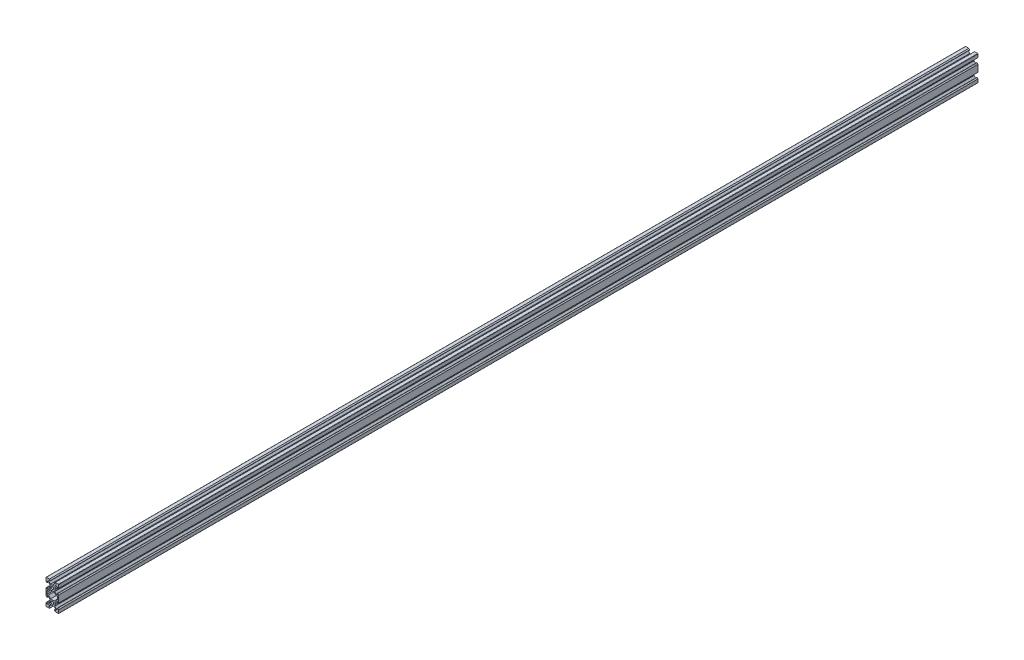
from build123d import *

# Parameters (mm, degrees)
SKETCH1_R           = 2.1
BOSS_EXTRUDE1_DEPTH = 1447.8


with BuildPart() as part:
    # Sketch1 → Boss-Extrude1 (new body)
    with BuildSketch(Plane.XY):
        with BuildLine():
            Line((4.58, -20), (9.5, -20))
            ThreePointArc((9.5, -20), (9.853553391, -19.853553391), (10, -19.5))
            Line((10, -19.5), (10, -14.58))
            Line((10, -14.58), (8.545, -13.125))
            Line((8.545, -13.125), (8.2, -13.125))
            Line((8.2, -13.125), (8.2, -15.5))
            Line((8.2, -15.5), (6.560660172, -15.5))
            Line((6.560660172, -15.5), (3.9, -12.839339828))
            Line((3.9, -12.839339828), (3.9, -10.21))
            Line((3.9, -10.21), (3.69, -10))
            Line((3.69, -10), (3.9, -9.79))
            Line((3.9, -9.79), (3.9, -7.160660172))
            Line((3.9, -7.160660172), (6.560660172, -4.5))
            Line((6.560660172, -4.5), (8.2, -4.5))
            Line((8.2, -4.5), (8.2, -6.875))
            Line((8.2, -6.875), (8.545, -6.875))
            Line((8.545, -6.875), (10, -5.42))
            Line((10, -5.42), (10, 5.42))
            Line((10, 5.42), (8.545, 6.875))
            Line((8.545, 6.875), (8.2, 6.875))
            Line((8.2, 6.875), (8.2, 4.5))
            Line((8.2, 4.5), (6.560660172, 4.5))
            Line((6.560660172, 4.5), (3.9, 7.160660172))
            Line((3.9, 7.160660172), (3.9, 9.79))
            Line((3.9, 9.79), (3.69, 10))
            Line((3.69, 10), (3.9, 10.21))
            Line((3.9, 10.21), (3.9, 12.839339828))
            Line((3.9, 12.839339828), (6.560660172, 15.5))
            Line((6.560660172, 15.5), (8.2, 15.5))
            Line((8.2, 15.5), (8.2, 13.125))
            Line((8.2, 13.125), (8.545, 13.125))
            Line((8.545, 13.125), (10, 14.58))
            Line((10, 14.58), (10, 19.5))
            ThreePointArc((10, 19.5), (9.853553391, 19.853553391), (9.5, 20))
            Line((9.5, 20), (4.58, 20))
            Line((4.58, 20), (3.125, 18.545))
            Line((3.125, 18.545), (3.125, 18.2))
            Line((3.125, 18.2), (5.5, 18.2))
            Line((5.5, 18.2), (5.5, 16.560660172))
            Line((5.5, 16.560660172), (2.839339828, 13.9))
            Line((2.839339828, 13.9), (0.21, 13.9))
            Line((0.21, 13.9), (0, 13.69))
            Line((0, 13.69), (-0.21, 13.9))
            Line((-0.21, 13.9), (-2.839339828, 13.9))
            Line((-2.839339828, 13.9), (-5.5, 16.560660172))
            Line((-5.5, 16.560660172), (-5.5, 18.2))
            Line((-5.5, 18.2), (-3.125, 18.2))
            Line((-3.125, 18.2), (-3.125, 18.545))
            Line((-3.125, 18.545), (-4.58, 20))
            Line((-4.58, 20), (-9.5, 20))
            ThreePointArc((-9.5, 20), (-9.853553391, 19.853553391), (-10, 19.5))
            Line((-10, 19.5), (-10, 14.58))
            Line((-10, 14.58), (-8.545, 13.125))
            Line((-8.545, 13.125), (-8.2, 13.125))
            Line((-8.2, 13.125), (-8.2, 15.5))
            Line((-8.2, 15.5), (-6.560660172, 15.5))
            Line((-6.560660172, 15.5), (-3.9, 12.839339828))
            Line((-3.9, 12.839339828), (-3.9, 10.21))
            Line((-3.9, 10.21), (-3.69, 10))
            Line((-3.69, 10), (-3.9, 9.79))
            Line((-3.9, 9.79), (-3.9, 7.160660172))
            Line((-3.9, 7.160660172), (-6.560660172, 4.5))
            Line((-6.560660172, 4.5), (-8.2, 4.5))
            Line((-8.2, 4.5), (-8.2, 6.875))
            Line((-8.2, 6.875), (-8.545, 6.875))
            Line((-8.545, 6.875), (-10, 5.42))
            Line((-10, 5.42), (-10, -5.42))
            Line((-10, -5.42), (-8.545, -6.875))
            Line((-8.545, -6.875), (-8.2, -6.875))
            Line((-8.2, -6.875), (-8.2, -4.5))
            Line((-8.2, -4.5), (-6.560660172, -4.5))
            Line((-6.560660172, -4.5), (-3.9, -7.160660172))
            Line((-3.9, -7.160660172), (-3.9, -9.79))
            Line((-3.9, -9.79), (-3.69, -10))
            Line((-3.69, -10), (-3.9, -10.21))
            Line((-3.9, -10.21), (-3.9, -12.839339828))
            Line((-3.9, -12.839339828), (-6.560660172, -15.5))
            Line((-6.560660172, -15.5), (-8.2, -15.5))
            Line((-8.2, -15.5), (-8.2, -13.125))
            Line((-8.2, -13.125), (-8.545, -13.125))
            Line((-8.545, -13.125), (-10, -14.58))
            Line((-10, -14.58), (-10, -19.5))
            ThreePointArc((-10, -19.5), (-9.853553391, -19.853553391), (-9.5, -20))
            Line((-9.5, -20), (-4.58, -20))
            Line((-4.58, -20), (-3.125, -18.545))
            Line((-3.125, -18.545), (-3.125, -18.2))
            Line((-3.125, -18.2), (-5.5, -18.2))
            Line((-5.5, -18.2), (-5.5, -16.560660172))
            Line((-5.5, -16.560660172), (-2.839339828, -13.9))
            Line((-2.839339828, -13.9), (-0.21, -13.9))
            Line((-0.21, -13.9), (0, -13.69))
            Line((0, -13.69), (0.21, -13.9))
            Line((0.21, -13.9), (2.839339828, -13.9))
            Line((2.839339828, -13.9), (5.5, -16.560660172))
            Line((5.5, -16.560660172), (5.5, -18.2))
            Line((5.5, -18.2), (3.125, -18.2))
            Line((3.125, -18.2), (3.125, -18.545))
            Line((3.125, -18.545), (4.58, -20))
        make_face()
        with Locations((0, -10)):
            Circle(SKETCH1_R, mode=Mode.SUBTRACT)
        Polygon((-6.239339828, -2.7), (-8.2, -2.7), (-8.2, 2.7), (-6.239339828, 2.7), (-2.839339828, 6.1), (2.839339828, 6.1), (6.239339828, 2.7), (8.2, 2.7), (8.2, -2.7), (6.239339828, -2.7), (2.839339828, -6.1), (-2.839339828, -6.1), align=None, mode=Mode.SUBTRACT)
        with Locations((0, 10)):
            Circle(SKETCH1_R, mode=Mode.SUBTRACT)
    extrude(amount=BOSS_EXTRUDE1_DEPTH)


solid = part.part
